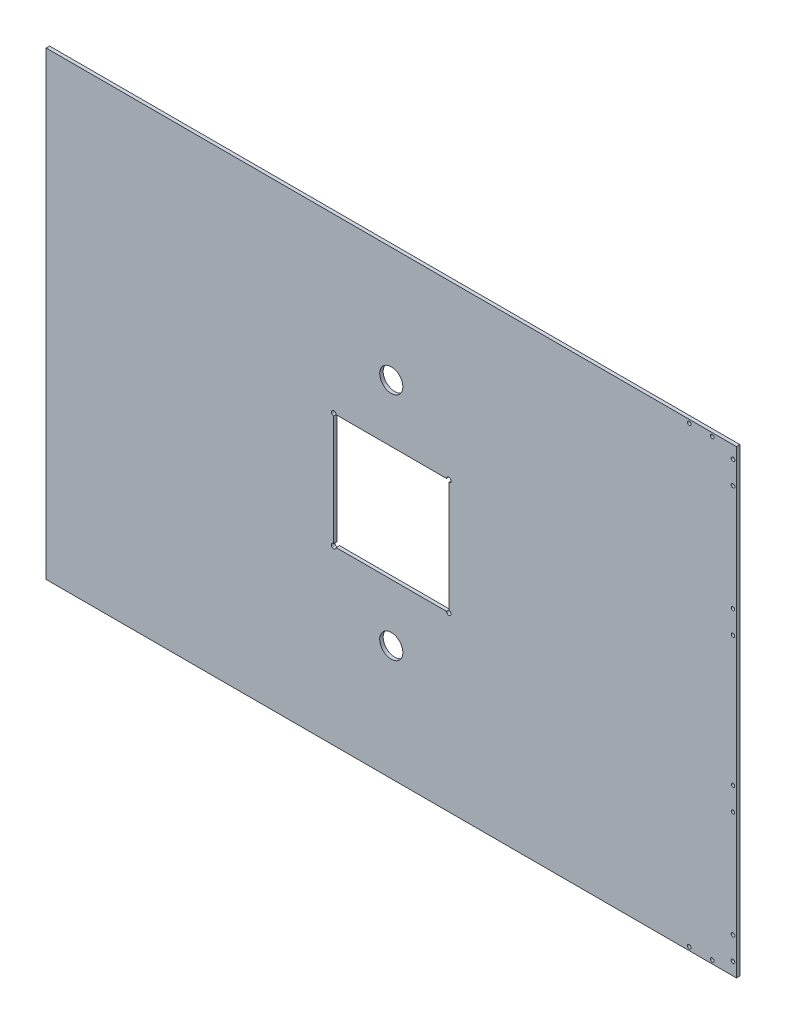
from build123d import *

# Parameters (mm, degrees)
SKETCH_1_W          = 600
SKETCH_1_H          = 400
EXTRUDE_1_DEPTH     = 3
SKETCH_3_W          = 100
SKETCH_3_H          = 100
CUT_EXTRUDE_1_DEPTH = 361.567608085
SKETCH_4_R          = 2
CUT_EXTRUDE_2_DEPTH = 361.567608085
SKETCH_5_R          = 1.6
CUT_EXTRUDE_3_DEPTH = 361.567608085
SKETCH_6_R          = 10.05
CUT_EXTRUDE_4_DEPTH = 361.567608085
SKETCH_7_R          = 1.5
CUT_EXTRUDE_5_DEPTH = 361.567608085


with BuildPart() as part:
    # 草图1 → 凸台-拉伸1 (new body)
    with BuildSketch(Plane.XY):
        Rectangle(SKETCH_1_W, SKETCH_1_H)
    extrude(amount=EXTRUDE_1_DEPTH)

    # 草图3 → 切除-拉伸1 (cut, through all)
    with BuildSketch(Plane(origin=(0, 0, 0), x_dir=(-1, 0, 0), z_dir=(0, 0, -1))):
        Rectangle(SKETCH_3_W, SKETCH_3_H)
    extrude(amount=-CUT_EXTRUDE_1_DEPTH, mode=Mode.SUBTRACT)

    # 草图4 → 切除-拉伸2 (cut, through all)
    with BuildSketch(Plane.XY.offset(3)):
        with Locations((-50, 50)):
            Circle(SKETCH_4_R)
        with Locations((-50, -50)):
            Circle(SKETCH_4_R)
        with Locations((50, -50)):
            Circle(SKETCH_4_R)
        with Locations((50, 50)):
            Circle(SKETCH_4_R)
    extrude(amount=-CUT_EXTRUDE_2_DEPTH, mode=Mode.SUBTRACT)

    # 草图5 → 切除-拉伸3 (cut, through all)
    with BuildSketch(Plane(origin=(0, 0, 0), x_dir=(-1, 0, 0), z_dir=(0, 0, -1))):
        with Locations((-297, 169)):
            Circle(SKETCH_5_R)
        with Locations((-297, 189)):
            Circle(SKETCH_5_R)
        with Locations((-279, 197)):
            Circle(SKETCH_5_R)
        with Locations((-259, 197)):
            Circle(SKETCH_5_R)
        with Locations(Location((-259, -197, 0), (0, 0, 180))):
            Circle(SKETCH_5_R)
        with Locations(Location((-279, -197, 0), (0, 0, 180))):
            Circle(SKETCH_5_R)
        with Locations(Location((-297, -189, 0), (0, 0, 180))):
            Circle(SKETCH_5_R)
        with Locations(Location((-297, -169, 0), (0, 0, 180))):
            Circle(SKETCH_5_R)
    extrude(amount=-CUT_EXTRUDE_3_DEPTH, mode=Mode.SUBTRACT)

    # 草图6 → 切除-拉伸4 (cut, through all)
    with BuildSketch(Plane(origin=(0, 0, 0), x_dir=(-1, 0, 0), z_dir=(0, 0, -1))):
        with Locations((0, 100)):
            Circle(SKETCH_6_R)
        with Locations(Location((0, -100, 0), (0, 0, 180))):
            Circle(SKETCH_6_R)
    extrude(amount=-CUT_EXTRUDE_4_DEPTH, mode=Mode.SUBTRACT)

    # 草图7 → 切除-拉伸5 (cut, through all)
    with BuildSketch(Plane(origin=(0, 0, 0), x_dir=(-1, 0, 0), z_dir=(0, 0, -1))):
        with Locations((-297, -56.5)):
            Circle(SKETCH_7_R)
        with Locations((-297, -76.5)):
            Circle(SKETCH_7_R)
        with Locations(Location((-297, 76.5, 0), (0, 0, 180))):
            Circle(SKETCH_7_R)
        with Locations(Location((-297, 56.5, 0), (0, 0, 180))):
            Circle(SKETCH_7_R)
    extrude(amount=-CUT_EXTRUDE_5_DEPTH, mode=Mode.SUBTRACT)


solid = part.part
